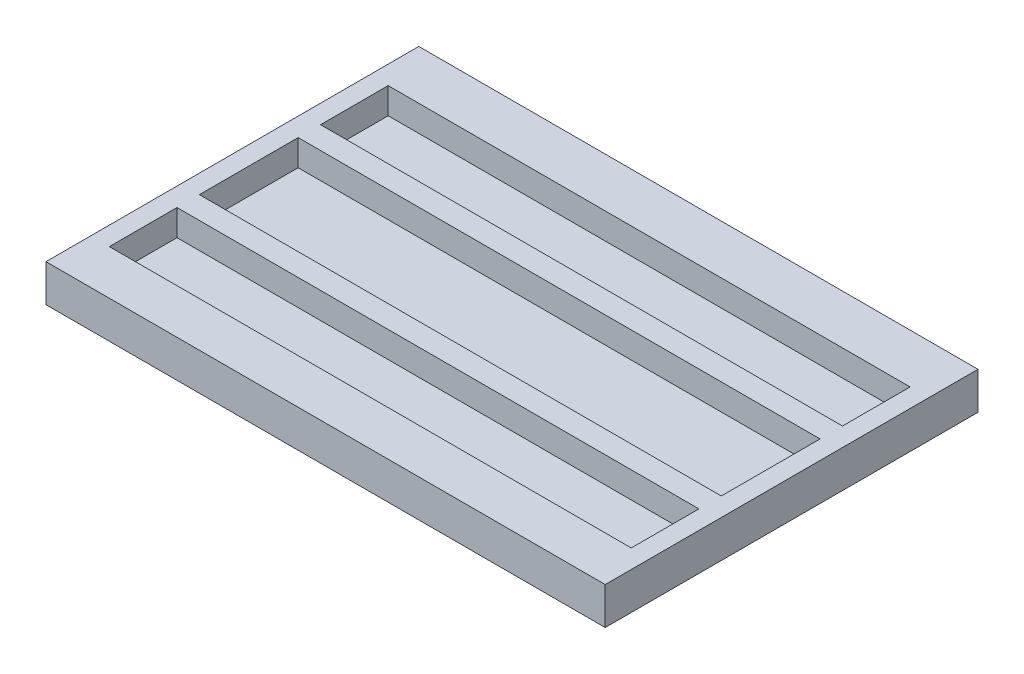
from build123d import *

# Parameters (mm, degrees)
SKETCH1_W           = 150
SKETCH1_H           = 100
BOSS_EXTRUDE1_DEPTH = 10
SKETCH2_W           = 140
SKETCH2_H           = 18.15
SKETCH2_H_2         = 26.498544255
CUT_EXTRUDE1_DEPTH  = 7


with BuildPart() as part:
    # Sketch1 → Boss-Extrude1 (new body)
    with BuildSketch(Plane(origin=(0, 0, 0), x_dir=(1, 0, 0), z_dir=(0, 1, 0))):
        Rectangle(SKETCH1_W, SKETCH1_H)
    extrude(amount=BOSS_EXTRUDE1_DEPTH)

    # Sketch2 → Cut-Extrude1 (cut)
    with BuildSketch(Plane(origin=(0, 10, 0), x_dir=(1, 0, 0), z_dir=(0, 1, 0))):
        with Locations((0, -28.933079552)):
            Rectangle(SKETCH2_W, SKETCH2_H)
        with Locations((0, 27.715464703)):
            Rectangle(SKETCH2_W, SKETCH2_H)
        with Locations((0, -0.608807425)):
            Rectangle(SKETCH2_W, SKETCH2_H_2)
    extrude(amount=-CUT_EXTRUDE1_DEPTH, mode=Mode.SUBTRACT)


solid = part.part
